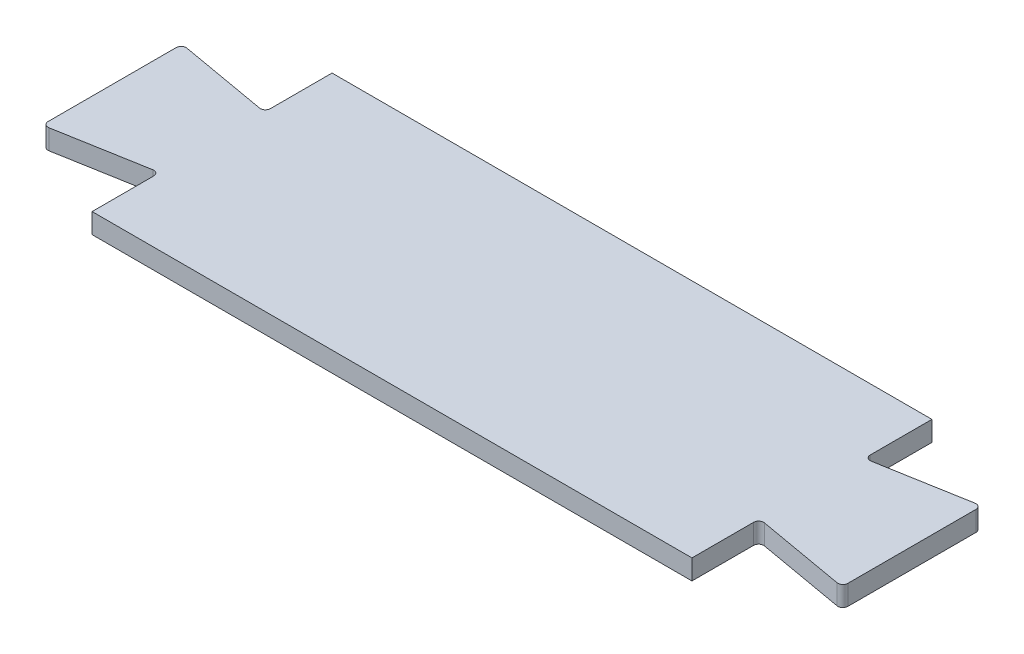
from build123d import *

# Parameters (mm, degrees)
BOSS_EXTRUDE1_DEPTH = 1
FILLET1_R           = 0.25


with BuildPart() as part:
    # Sketch1 → Boss-Extrude1 (new body)
    with BuildSketch(Plane(origin=(0, 0, 0), x_dir=(1, 0, 0), z_dir=(0, 1, 0))):
        Polygon((-15, 2.618365096), (-20, 3.5), (-20, -3.5), (-15, -2.618365096), (-15, -6), (15, -6), (15, -2.618365096), (20, -3.5), (20, 3.5), (15, 2.618365096), (15, 6), (-15, 6), align=None)
    extrude(amount=BOSS_EXTRUDE1_DEPTH)

    # Fillet1
    fillet1_edges = [part.edges().sort_by_distance(p)[0] for p in [
        (15, 0.5, -2.618365096),
        (20, 0.5, -3.5),
        (20, 0.5, 3.5),
        (15, 0.5, 2.618365096),
        (-15, 0.5, 2.618365096),
        (-20, 0.5, 3.5),
        (-20, 0.5, -3.5),
        (-15, 0.5, -2.618365096),
    ]]
    fillet(fillet1_edges, radius=FILLET1_R)


solid = part.part
